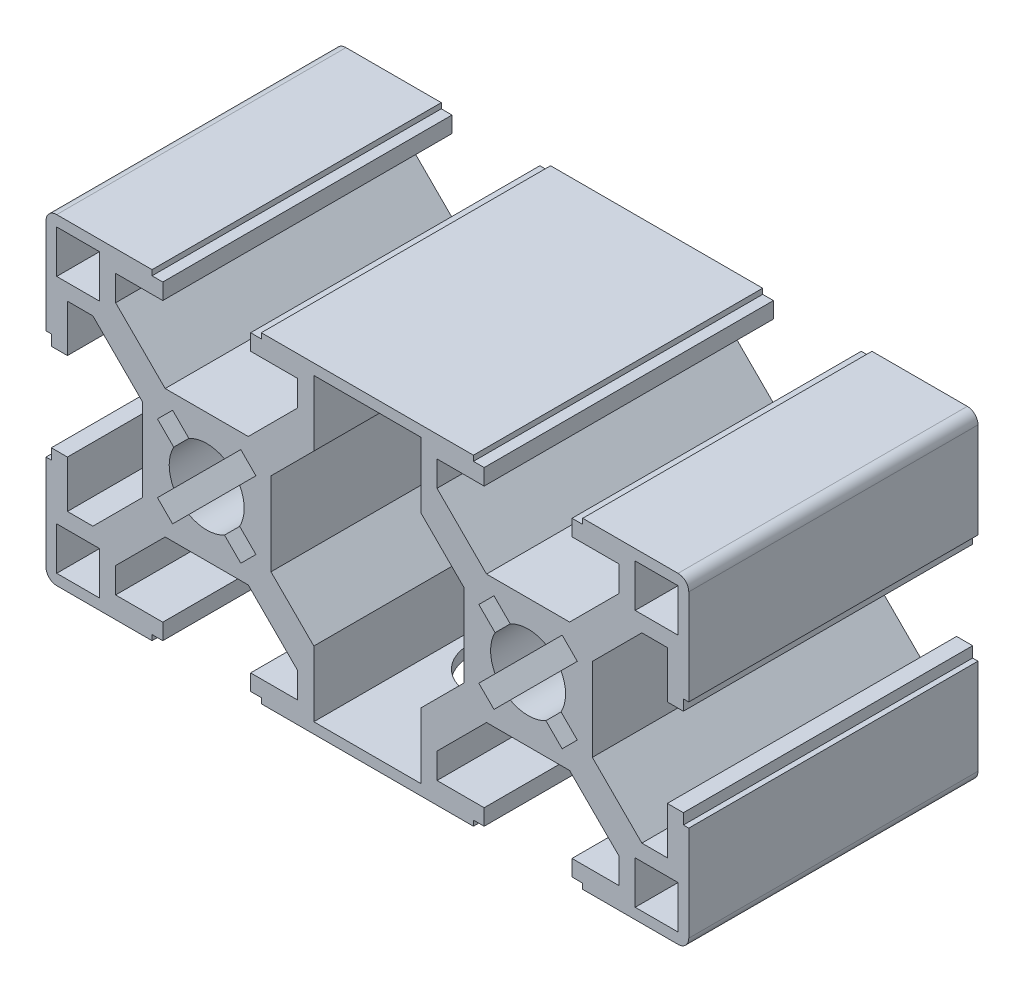
from build123d import *

# Parameters (mm, degrees)
ESBO_O1_W                      = 4
ESBO_O1_H                      = 4
RESSALTO_EXTRUS_O1_DEPTH       = 27
PADR_OCIRCULAR1_COUNT          = 4
PADR_O_LINEAR1_COUNT           = 2
PADR_O_LINEAR1_PITCH           = 30
PADR_O_LINEAR1_COPY_1_SKETCH_W = 4
PADR_O_LINEAR1_COPY_1_SKETCH_H = 4
PADR_O_LINEAR1_COPY_1_DEPTH    = 27
PADR_O_LINEAR1_COPY_2_SKETCH_W = 4
PADR_O_LINEAR1_COPY_2_SKETCH_H = 4
PADR_O_LINEAR1_COPY_2_DEPTH    = 27
PADR_O_LINEAR1_COPY_3_SKETCH_W = 4
PADR_O_LINEAR1_COPY_3_SKETCH_H = 4
PADR_O_LINEAR1_COPY_3_DEPTH    = 27
ESBO_O4_W                      = 10
ESBO_O4_H                      = 28
CORTE_EXTRUS_O1_DEPTH          = 55.580216196
FILETE1_R                      = 1
SKETCH1_R                      = 2.5
SKETCH1_R_2                    = 4
CUT_EXTRUDE1_DEPTH             = 6


with BuildPart() as part:
    # Esboço1 → Ressalto-extrusão1 (new body)
    with BuildSketch(Plane.XY):
        with BuildLine():
            ThreePointArc((-1.664601464, 3.078815026), (-0.858529967, 3.393070335), (0, 3.5))
            Line((0, 3.5), (0, 6))
            Line((0, 6), (-3.878679656, 6))
            Line((-3.878679656, 6), (-8.5, 10.621320344))
            Line((-8.5, 10.621320344), (-8.5, 13))
            Line((-8.5, 13), (-4.1, 13))
            Line((-4.1, 13), (-4.1, 14.5))
            Line((-4.1, 14.5), (-5.1, 14.5))
            Line((-5.1, 14.5), (-5.1, 15))
            Line((-5.1, 15), (-15, 15))
            Line((-15, 15), (-15, 5.1))
            Line((-15, 5.1), (-14.5, 5.1))
            Line((-14.5, 5.1), (-14.5, 4.1))
            Line((-14.5, 4.1), (-13, 4.1))
            Line((-13, 4.1), (-13, 8.5))
            Line((-13, 8.5), (-10.621320344, 8.5))
            Line((-10.621320344, 8.5), (-6, 3.878679656))
            Line((-6, 3.878679656), (-6, 0))
            Line((-6, 0), (-3.5, 0))
            ThreePointArc((-3.5, 0), (-3.393070335, 0.858529967), (-3.078815026, 1.664601464))
            Line((-3.078815026, 1.664601464), (-4.596194078, 3.181980515))
            Line((-4.596194078, 3.181980515), (-3.181980515, 4.596194078))
            Line((-3.181980515, 4.596194078), (-1.664601464, 3.078815026))
        make_face()
        with Locations((-12, 12)):
            Rectangle(ESBO_O1_W, ESBO_O1_H, mode=Mode.SUBTRACT)
    ressalto_extrus_o1 = extrude(amount=RESSALTO_EXTRUS_O1_DEPTH)

    # PadrãoCircular1: Ressalto-extrusão1 ×4 about axis
    padr_ocircular1_axis = Axis((0, 0, 0), (0, 0, 1))
    for i in range(1, PADR_OCIRCULAR1_COUNT):
        add(ressalto_extrus_o1.rotate(padr_ocircular1_axis, i * 360 / PADR_OCIRCULAR1_COUNT))

    # Padrão linear1: Ressalto-extrusão1 ×2
    with Locations(*[(i * PADR_O_LINEAR1_PITCH, 0, 0) for i in range(1, PADR_O_LINEAR1_COUNT)]):
        add(ressalto_extrus_o1)

    # Padrão linear1 copy 1 sketch → Padrão linear1 copy 1 (add)
    with BuildSketch(Plane(origin=(30, 0, 0), x_dir=(0, 1, 0), z_dir=(0, 0, 1))):
        with BuildLine():
            ThreePointArc((-1.664601464, 3.078815026), (-0.858529967, 3.393070335), (0, 3.5))
            Line((0, 3.5), (0, 6))
            Line((0, 6), (-3.878679656, 6))
            Line((-3.878679656, 6), (-8.5, 10.621320344))
            Line((-8.5, 10.621320344), (-8.5, 13))
            Line((-8.5, 13), (-4.1, 13))
            Line((-4.1, 13), (-4.1, 14.5))
            Line((-4.1, 14.5), (-5.1, 14.5))
            Line((-5.1, 14.5), (-5.1, 15))
            Line((-5.1, 15), (-15, 15))
            Line((-15, 15), (-15, 5.1))
            Line((-15, 5.1), (-14.5, 5.1))
            Line((-14.5, 5.1), (-14.5, 4.1))
            Line((-14.5, 4.1), (-13, 4.1))
            Line((-13, 4.1), (-13, 8.5))
            Line((-13, 8.5), (-10.621320344, 8.5))
            Line((-10.621320344, 8.5), (-6, 3.878679656))
            Line((-6, 3.878679656), (-6, 0))
            Line((-6, 0), (-3.5, 0))
            ThreePointArc((-3.5, 0), (-3.393070335, 0.858529967), (-3.078815026, 1.664601464))
            Line((-3.078815026, 1.664601464), (-4.596194078, 3.181980515))
            Line((-4.596194078, 3.181980515), (-3.181980515, 4.596194078))
            Line((-3.181980515, 4.596194078), (-1.664601464, 3.078815026))
        make_face()
        with Locations((-12, 12)):
            Rectangle(PADR_O_LINEAR1_COPY_1_SKETCH_W, PADR_O_LINEAR1_COPY_1_SKETCH_H, mode=Mode.SUBTRACT)
    extrude(amount=PADR_O_LINEAR1_COPY_1_DEPTH)

    # Padrão linear1 copy 2 sketch → Padrão linear1 copy 2 (add)
    with BuildSketch(Plane(origin=(30, 0, 0), x_dir=(-1, 0, 0), z_dir=(0, 0, 1))):
        with BuildLine():
            ThreePointArc((-1.664601464, 3.078815026), (-0.858529967, 3.393070335), (0, 3.5))
            Line((0, 3.5), (0, 6))
            Line((0, 6), (-3.878679656, 6))
            Line((-3.878679656, 6), (-8.5, 10.621320344))
            Line((-8.5, 10.621320344), (-8.5, 13))
            Line((-8.5, 13), (-4.1, 13))
            Line((-4.1, 13), (-4.1, 14.5))
            Line((-4.1, 14.5), (-5.1, 14.5))
            Line((-5.1, 14.5), (-5.1, 15))
            Line((-5.1, 15), (-15, 15))
            Line((-15, 15), (-15, 5.1))
            Line((-15, 5.1), (-14.5, 5.1))
            Line((-14.5, 5.1), (-14.5, 4.1))
            Line((-14.5, 4.1), (-13, 4.1))
            Line((-13, 4.1), (-13, 8.5))
            Line((-13, 8.5), (-10.621320344, 8.5))
            Line((-10.621320344, 8.5), (-6, 3.878679656))
            Line((-6, 3.878679656), (-6, 0))
            Line((-6, 0), (-3.5, 0))
            ThreePointArc((-3.5, 0), (-3.393070335, 0.858529967), (-3.078815026, 1.664601464))
            Line((-3.078815026, 1.664601464), (-4.596194078, 3.181980515))
            Line((-4.596194078, 3.181980515), (-3.181980515, 4.596194078))
            Line((-3.181980515, 4.596194078), (-1.664601464, 3.078815026))
        make_face()
        with Locations((-12, 12)):
            Rectangle(PADR_O_LINEAR1_COPY_2_SKETCH_W, PADR_O_LINEAR1_COPY_2_SKETCH_H, mode=Mode.SUBTRACT)
    extrude(amount=PADR_O_LINEAR1_COPY_2_DEPTH)

    # Padrão linear1 copy 3 sketch → Padrão linear1 copy 3 (add)
    with BuildSketch(Plane(origin=(30, 0, 0), x_dir=(0, -1, 0), z_dir=(0, 0, 1))):
        with BuildLine():
            ThreePointArc((-1.664601464, 3.078815026), (-0.858529967, 3.393070335), (0, 3.5))
            Line((0, 3.5), (0, 6))
            Line((0, 6), (-3.878679656, 6))
            Line((-3.878679656, 6), (-8.5, 10.621320344))
            Line((-8.5, 10.621320344), (-8.5, 13))
            Line((-8.5, 13), (-4.1, 13))
            Line((-4.1, 13), (-4.1, 14.5))
            Line((-4.1, 14.5), (-5.1, 14.5))
            Line((-5.1, 14.5), (-5.1, 15))
            Line((-5.1, 15), (-15, 15))
            Line((-15, 15), (-15, 5.1))
            Line((-15, 5.1), (-14.5, 5.1))
            Line((-14.5, 5.1), (-14.5, 4.1))
            Line((-14.5, 4.1), (-13, 4.1))
            Line((-13, 4.1), (-13, 8.5))
            Line((-13, 8.5), (-10.621320344, 8.5))
            Line((-10.621320344, 8.5), (-6, 3.878679656))
            Line((-6, 3.878679656), (-6, 0))
            Line((-6, 0), (-3.5, 0))
            ThreePointArc((-3.5, 0), (-3.393070335, 0.858529967), (-3.078815026, 1.664601464))
            Line((-3.078815026, 1.664601464), (-4.596194078, 3.181980515))
            Line((-4.596194078, 3.181980515), (-3.181980515, 4.596194078))
            Line((-3.181980515, 4.596194078), (-1.664601464, 3.078815026))
        make_face()
        with Locations((-12, 12)):
            Rectangle(PADR_O_LINEAR1_COPY_3_SKETCH_W, PADR_O_LINEAR1_COPY_3_SKETCH_H, mode=Mode.SUBTRACT)
    extrude(amount=PADR_O_LINEAR1_COPY_3_DEPTH)

    # Esboço4 → Corte-extrusão1 (cut, through all)
    with BuildSketch(Plane(origin=(0, 0, 0), x_dir=(-1, 0, 0), z_dir=(0, 0, -1))):
        with Locations((-15, 0)):
            Rectangle(ESBO_O4_W, ESBO_O4_H)
    extrude(amount=-CORTE_EXTRUS_O1_DEPTH, mode=Mode.SUBTRACT)

    # Filete1
    filete1_edges = [part.edges().sort_by_distance(p)[0] for p in [
        (45, -15, 13.5),
        (45, 15, 13.5),
        (-15, 15, 13.5),
        (-15, -15, 13.5),
    ]]
    fillet(filete1_edges, radius=FILETE1_R)

    # Sketch1 → Cut-Extrude1 (cut)
    with BuildSketch(Plane.XZ.offset(15)):
        with Locations((33.25, 13.5)):
            Circle(SKETCH1_R)
        with Locations((-3.25, 13.5)):
            Circle(SKETCH1_R)
        with Locations(Location((15, 13.5, 0), (0, 0, 270))):
            Circle(SKETCH1_R_2)
    extrude(amount=-CUT_EXTRUDE1_DEPTH, mode=Mode.SUBTRACT)


solid = part.part
